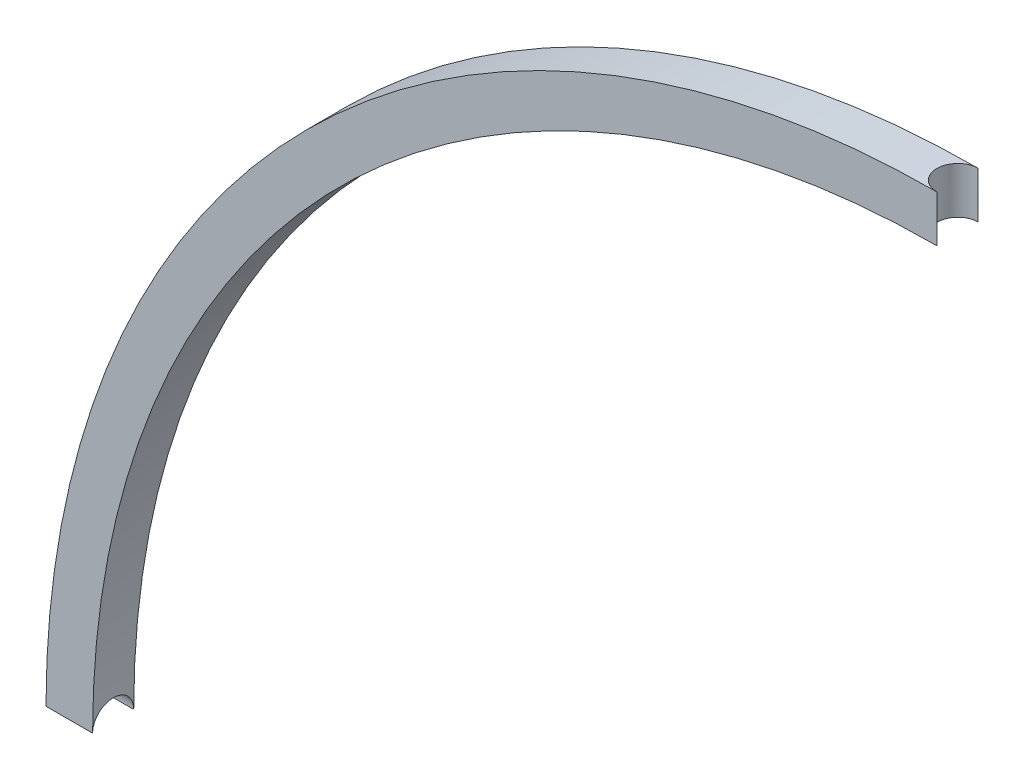
from build123d import *

# Parameters (mm, degrees)
BOSS_EXTRUDE1_DEPTH = 6
SKETCH6_R           = 3
CUT_EXTRUDE2_DEPTH  = 144
SKETCH7_R           = 3
CUT_EXTRUDE3_DEPTH  = 144


with BuildPart() as part:
    # Sketch5 → Boss-Extrude1 (new body)
    with BuildSketch(Plane.XY):
        with BuildLine():
            Line((0, 123.2), (0, 130))
            ThreePointArc((0, 130), (-91.923881554, 91.923881554), (-130, 0))
            Line((-130, 0), (-123.2, 0))
            ThreePointArc((-123.2, 0), (-87.115555442, 87.115555442), (0, 123.2))
        make_face()
    extrude(amount=BOSS_EXTRUDE1_DEPTH)

    # Sketch6 → Cut-Extrude2 (cut)
    with BuildSketch(Plane(origin=(0, 0, 0), x_dir=(1, 0, 0), z_dir=(0, 1, 0))):
        with Locations((0, -3)):
            Circle(SKETCH6_R)
    extrude(amount=CUT_EXTRUDE2_DEPTH, mode=Mode.SUBTRACT)

    # Sketch7 → Cut-Extrude3 (cut)
    with BuildSketch(Plane(origin=(0, 0, 0), x_dir=(0, 0, -1), z_dir=(1, 0, 0))):
        with Locations((-3, 0)):
            Circle(SKETCH7_R)
    extrude(amount=-CUT_EXTRUDE3_DEPTH, mode=Mode.SUBTRACT)


solid = part.part
